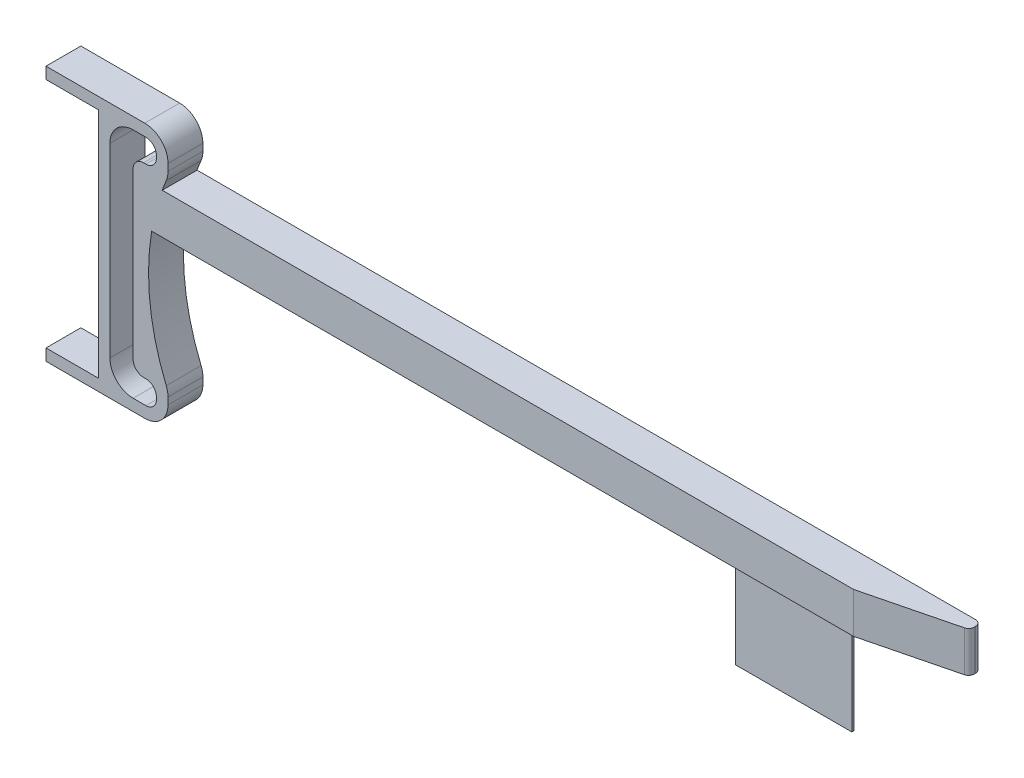
from build123d import *

# Parameters (mm, degrees)
HOOK_DEPTH          = 3
SKETCH2_W           = 70
SKETCH2_H           = 3.5
PIN_DEPTH           = 3
CUT_EXTRUDE1_DEPTH  = 3.5
FILLET1_R           = 0.5
SKETCH4_W           = 10
SKETCH4_H           = 10
BOSS_EXTRUDE3_DEPTH = 0.2


with BuildPart() as part:
    # Sketch1 → Hook (new body)
    with BuildSketch(Plane.XY):
        with BuildLine():
            Line((1, -11), (-3, -11))
            Line((-3, -11), (-7.5, -11))
            Line((-7.5, -11), (-7.5, -10))
            Line((-7.5, -10), (-3, -10))
            Line((-3, -10), (-3, 10))
            Line((-3, 10), (-7.5, 10))
            Line((-7.5, 10), (-7.5, 11))
            Line((-7.5, 11), (-3, 11))
            Line((-3, 11), (1, 11))
            ThreePointArc((1, 11), (2.414213562, 10.414213562), (3, 9))
            Line((3, 9), (3, 8.408634703))
            ThreePointArc((3, 8.408634703), (2.961405113, 8.017623214), (2.847110016, 7.64170277))
            ThreePointArc((2.847110016, 7.64170277), (1.32371561, 0), (2.847110016, -7.64170277))
            ThreePointArc((2.847110016, -7.64170277), (2.961405113, -8.017623214), (3, -8.408634703))
            Line((3, -8.408634703), (3, -9))
            ThreePointArc((3, -9), (2.414213562, -10.414213562), (1, -11))
        make_face()
        with BuildLine():
            Line((2, 8.9), (2, 9.1))
            ThreePointArc((2, 9.1), (1.736396103, 9.736396103), (1.1, 10))
            Line((1.1, 10), (0, 10))
            ThreePointArc((0, 10), (-1.414213562, 9.414213562), (-2, 8))
            Line((-2, 8), (-2, -8))
            ThreePointArc((-2, -8), (-1.414213562, -9.414213562), (0, -10))
            Line((0, -10), (1.1, -10))
            ThreePointArc((1.1, -10), (1.736396103, -9.736396103), (2, -9.1))
            Line((2, -9.1), (2, -8.9))
            ThreePointArc((2, -8.9), (1.736396103, -8.263603897), (1.1, -8))
            Line((1.1, -8), (0.9, -8))
            ThreePointArc((0.9, -8), (0.263603897, -7.736396103), (0, -7.1))
            Line((0, -7.1), (0, 7.1))
            ThreePointArc((0, 7.1), (0.263603897, 7.736396103), (0.9, 8))
            Line((0.9, 8), (1.1, 8))
            ThreePointArc((1.1, 8), (1.736396103, 8.263603897), (2, 8.9))
        make_face(mode=Mode.SUBTRACT)
    extrude(amount=HOOK_DEPTH)

    # Sketch2 → Pin (add)
    with BuildSketch(Plane.XY):
        with Locations((35, 5)):
            Rectangle(SKETCH2_W, SKETCH2_H)
    extrude(amount=PIN_DEPTH)

    # Sketch3 → Cut-Extrude1 (cut)
    with BuildSketch(Plane.XZ.offset(-3.25)):
        Polygon((62, 3), (70, 3), (70, 1), align=None)
    extrude(amount=-CUT_EXTRUDE1_DEPTH, mode=Mode.SUBTRACT)

    # Fillet1
    fillet1_edges = [part.edges().sort_by_distance(p)[0] for p in [
        (70, 5, 0),
        (70, 5, 1),
    ]]
    fillet(fillet1_edges, radius=FILLET1_R)

    # Sketch4 → Boss-Extrude3 (add)
    with BuildSketch(Plane.XY):
        with Locations((54.047822984, -1.75)):
            Rectangle(SKETCH4_W, SKETCH4_H)
    extrude(amount=BOSS_EXTRUDE3_DEPTH)


solid = part.part
